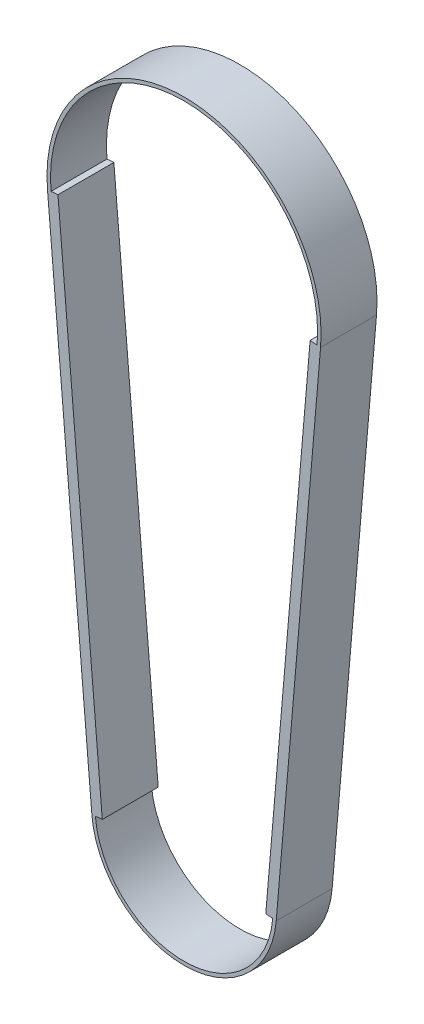
from build123d import *

# Parameters (mm, degrees)
BOSS_EXTRUDE1_DEPTH = 32
SKETCH2_W           = 32
SKETCH2_H           = 297.871609812
BOSS_EXTRUDE2_DEPTH = 4
SKETCH3_W           = 32
SKETCH3_H           = 297.871609812
BOSS_EXTRUDE3_DEPTH = 4


with BuildPart() as part:
    # Sketch1 → Boss-Extrude1 (new body)
    with BuildSketch(Plane.XY):
        with BuildLine():
            Line((-78.105635002, -6.676845901), (-52.734667386, -303.466013381))
            ThreePointArc((-52.734667386, -303.466013381), (0, -351.885), (52.734667386, -303.466013381))
            Line((52.734667386, -303.466013381), (78.105635002, -6.676845901))
            ThreePointArc((78.105635002, -6.676845901), (0, 78.3905), (-78.105635002, -6.676845901))
        make_face()
        with BuildLine():
            Line((-76.112902847, -6.506497557), (-50.741935231, -303.295665038))
            ThreePointArc((-50.741935231, -303.295665038), (0, -349.885), (50.741935231, -303.295665038))
            Line((50.741935231, -303.295665038), (76.112902847, -6.506497557))
            ThreePointArc((76.112902847, -6.506497557), (0, 76.3905), (-76.112902847, -6.506497557))
        make_face(mode=Mode.SUBTRACT)
    extrude(amount=BOSS_EXTRUDE1_DEPTH)

    # Sketch2 → Boss-Extrude2 (add)
    with BuildSketch(Plane(origin=(76.112902847, -6.506497557, 0), x_dir=(0, 0, 1), z_dir=(-0.996366077547994, 0.08517417162276966, 0))):
        with Locations((16, -148.935804906)):
            Rectangle(SKETCH2_W, SKETCH2_H)
    extrude(amount=BOSS_EXTRUDE2_DEPTH)

    # Sketch3 → Boss-Extrude3 (add)
    with BuildSketch(Plane(origin=(-76.112902847, -6.506497557, 0), x_dir=(0, 0, -1), z_dir=(0.9963660775479939, 0.08517417162276988, 0))):
        with Locations((-16, -148.935804906)):
            Rectangle(SKETCH3_W, SKETCH3_H)
    extrude(amount=BOSS_EXTRUDE3_DEPTH)


solid = part.part
